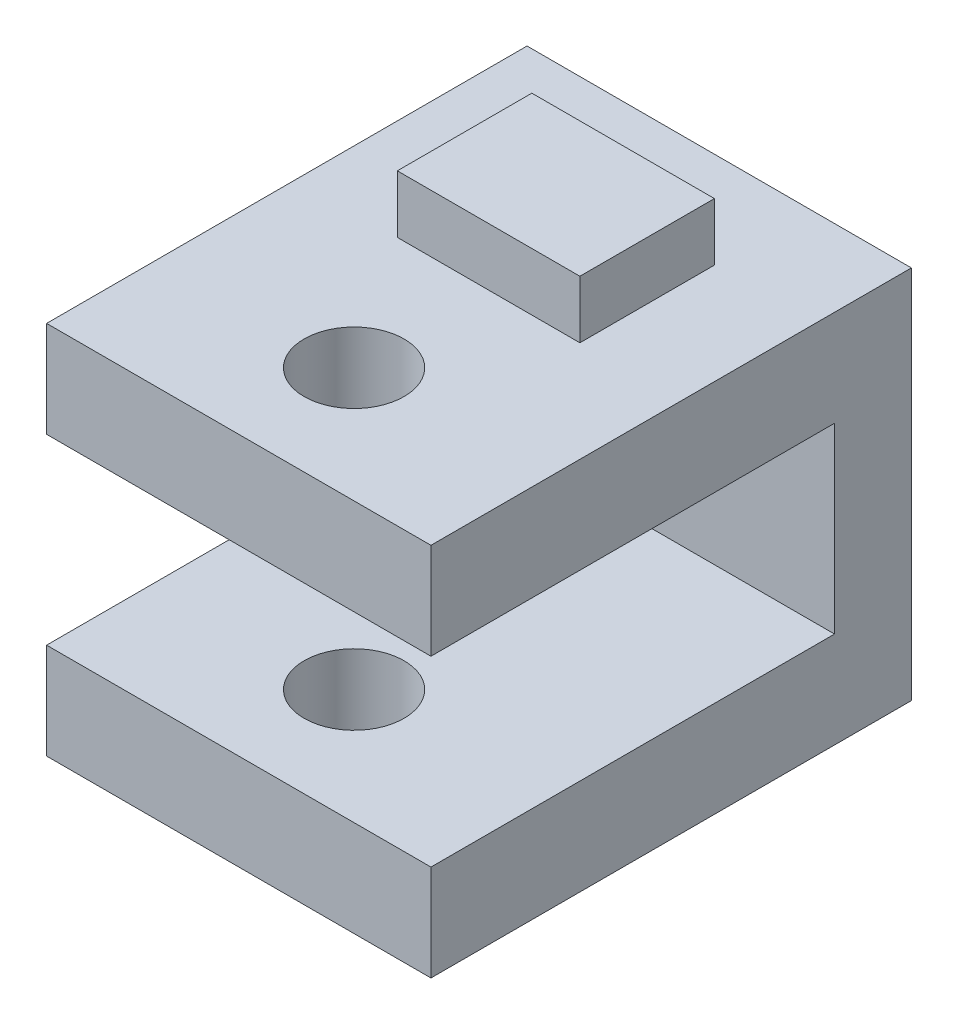
from build123d import *

# Parameters (mm, degrees)
SKETCH_1_W          = 20
SKETCH_1_H          = 19.5
EXTRUDE_1_DEPTH     = 4
SKETCH_2_W          = 20
SKETCH_2_H          = 5
EXTRUDE_2_DEPTH     = 21
SKETCH_3_W          = 9.5
SKETCH_3_H          = 7
EXTRUDE_3_DEPTH     = 3
SKETCH_4_W          = 9.5
SKETCH_4_H          = 7
EXTRUDE_4_DEPTH     = 3
SKETCH_5_R          = 2.6
CUT_EXTRUDE_1_DEPTH = 36.089172119
SKETCH_6_R          = 2.6
CUT_EXTRUDE_2_DEPTH = 30.791987178


with BuildPart() as part:
    # 草图1 → 凸台-拉伸1 (new body)
    with BuildSketch(Plane.XY):
        Rectangle(SKETCH_1_W, SKETCH_1_H)
    extrude(amount=EXTRUDE_1_DEPTH)

    # 草图2 → 凸台-拉伸2 (add)
    with BuildSketch(Plane.XY.offset(4)):
        with Locations((0, 7.25)):
            Rectangle(SKETCH_2_W, SKETCH_2_H)
        with Locations((0, -7.25)):
            Rectangle(SKETCH_2_W, SKETCH_2_H)
    extrude(amount=EXTRUDE_2_DEPTH)

    # 草图3 → 凸台-拉伸3 (add)
    with BuildSketch(Plane(origin=(0, 9.75, 0), x_dir=(1, 0, 0), z_dir=(0, 1, 0))):
        with Locations((0, -8.5)):
            Rectangle(SKETCH_3_W, SKETCH_3_H)
    extrude(amount=EXTRUDE_3_DEPTH)

    # 草图4 → 凸台-拉伸4 (add)
    with BuildSketch(Plane.XZ.offset(9.75)):
        with Locations((0, 8.5)):
            Rectangle(SKETCH_4_W, SKETCH_4_H)
    extrude(amount=EXTRUDE_4_DEPTH)

    # 草图5 → 切除-拉伸1 (cut, through all)
    with BuildSketch(Plane(origin=(0, 9.75, 0), x_dir=(1, 0, 0), z_dir=(0, 1, 0))):
        with Locations(Location((0, -19, 0), (0, 0, 270))):
            Circle(SKETCH_5_R)
    extrude(amount=-CUT_EXTRUDE_1_DEPTH, mode=Mode.SUBTRACT)

    # 草图6 → 切除-拉伸2 (cut, through all)
    with BuildSketch(Plane(origin=(0, 0, 0), x_dir=(-1, 0, 0), z_dir=(0, 0, -1))):
        Circle(SKETCH_6_R)
    extrude(amount=-CUT_EXTRUDE_2_DEPTH, mode=Mode.SUBTRACT)


solid = part.part
